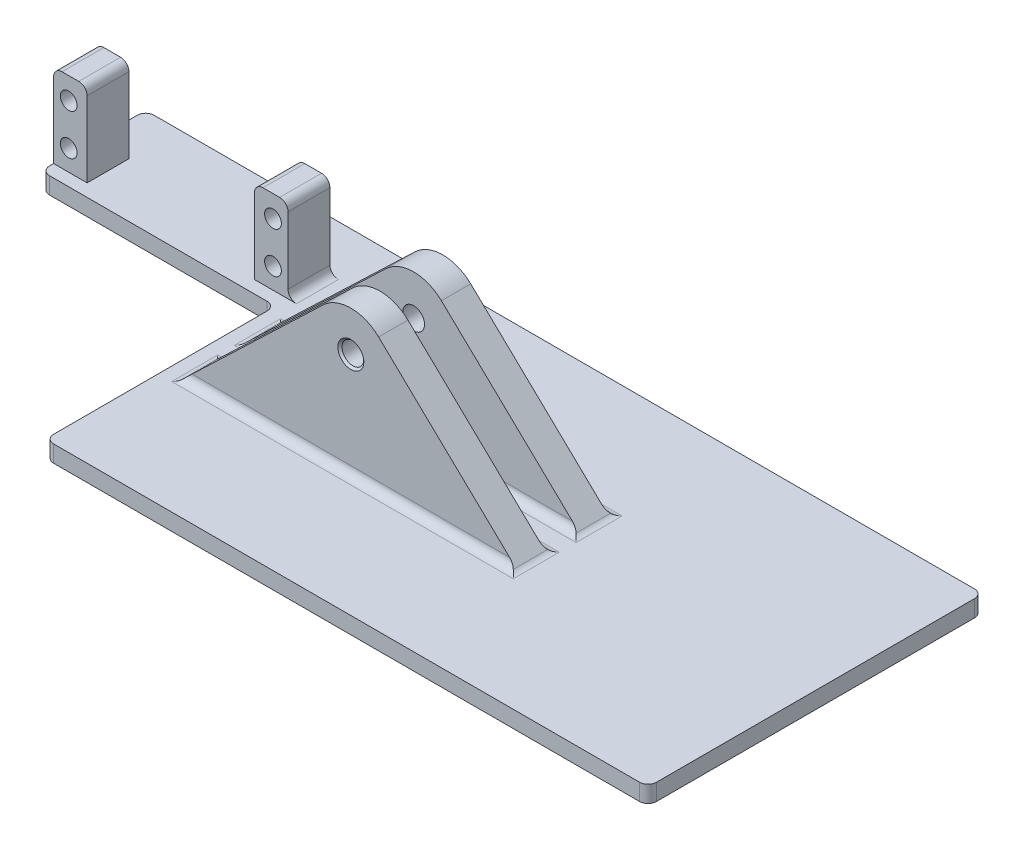
from build123d import *

# Parameters (mm, degrees)
SKETCH1_R           = 2.6
BOSS_EXTRUDE1_DEPTH = 22
SKETCH2_W           = 200
SKETCH2_H           = 80
BOSS_EXTRUDE2_DEPTH = 4
SKETCH3_W           = 8
SKETCH3_H           = 35
CUT_EXTRUDE1_DEPTH  = 209.42744541
CHAMFER1_SIZE       = 0.5
BOSS_EXTRUDE3_START = -22
SKETCH4_W           = 8
SKETCH4_H           = 20
SKETCH4_R           = 2
BOSS_EXTRUDE3_DEPTH = 10
SKETCH5_W           = 56
SKETCH5_H           = 55
CUT_EXTRUDE2_DEPTH  = 7
FILLET1_R           = 2


with BuildPart() as part:
    # Sketch1 → Boss-Extrude1 (new body)
    with BuildSketch(Plane.XY):
        with BuildLine():
            Line((-6.63831163, 6.934898608), (-40, -25))
            Line((-40, -25), (40, -25))
            Line((40, -25), (6.63831163, 6.934898608))
            ThreePointArc((6.63831163, 6.934898608), (0, 9.6), (-6.63831163, 6.934898608))
        make_face()
        Circle(SKETCH1_R, mode=Mode.SUBTRACT)
    extrude(amount=BOSS_EXTRUDE1_DEPTH)

    # Sketch2 → Boss-Extrude2 (add)
    with BuildSketch(Plane(origin=(0, -25, 0), x_dir=(-1, 0, 0), z_dir=(0, -1, 0))):
        with Locations((0, -11)):
            Rectangle(SKETCH2_W, SKETCH2_H)
    extrude(amount=BOSS_EXTRUDE2_DEPTH)

    # Sketch3 → Cut-Extrude1 (cut, through all)
    with BuildSketch(Plane(origin=(100, 0, 0), x_dir=(0, 0, -1), z_dir=(1, 0, 0))):
        with Locations((-11, -7.5)):
            Rectangle(SKETCH3_W, SKETCH3_H)
    extrude(amount=-CUT_EXTRUDE1_DEPTH, mode=Mode.SUBTRACT)

    # Chamfer1
    chamfer1_edges = [part.edges().sort_by_distance(p)[0] for p in [
        (-2.6, 0, 0),
        (-2.6, 0, 22),
    ]]
    chamfer(chamfer1_edges, length=CHAMFER1_SIZE)

    # Sketch4 → Boss-Extrude3 (add)
    # profile 1 of 2: a face of its own
    with BuildSketch(Plane(origin=(0, 0, -29), x_dir=(-1, 0, 0), z_dir=(0, 0, -1)).offset(BOSS_EXTRUDE3_START)):
        with Locations((96, -15)):
            Rectangle(SKETCH4_W, SKETCH4_H)
        with Locations((96.4, -20)):
            Circle(SKETCH4_R, mode=Mode.SUBTRACT)
        with Locations((96.4, -10.2)):
            Circle(SKETCH4_R, mode=Mode.SUBTRACT)
    # profile 2 of 2: a face of its own
    with BuildSketch(Plane(origin=(0, 0, -29), x_dir=(-1, 0, 0), z_dir=(0, 0, -1)).offset(BOSS_EXTRUDE3_START)):
        with Locations((48, -15)):
            Rectangle(SKETCH4_W, SKETCH4_H)
        with Locations(Location((47.6, -20, 0), (0, 0, 180))):
            Circle(SKETCH4_R, mode=Mode.SUBTRACT)
        with Locations(Location((47.6, -10.2, 0), (0, 0, 180))):
            Circle(SKETCH4_R, mode=Mode.SUBTRACT)
    extrude(amount=BOSS_EXTRUDE3_DEPTH)

    # Sketch5 → Cut-Extrude2 (cut)
    with BuildSketch(Plane(origin=(0, -25, 0), x_dir=(1, 0, 0), z_dir=(0, 1, 0))):
        with Locations((-72, -23.5)):
            Rectangle(SKETCH5_W, SKETCH5_H)
    extrude(amount=-CUT_EXTRUDE2_DEPTH, mode=Mode.SUBTRACT)

    # Fillet1
    fillet1_edges = [part.edges().sort_by_distance(p)[0] for p in [
        (-100, -5, -12),
        (-92, -5, -12),
        (-44, -5, -12),
        (-52, -5, -12),
        (-44, -25, -12),
        (0, -25, 0),
        (0, -25, 15),
        (-40, -25, 18.5),
        (0, -25, 7),
        (-40, -25, 3.5),
        (0, -25, 22),
        (40, -25, 3.5),
        (40, -25, 18.5),
        (100, -27, -29),
        (100, -27, 51),
        (-100, -27, -29),
        (-44, -27, -4),
        (-44, -27, 51),
        (-100, -27, -4),
    ]]
    fillet(fillet1_edges, radius=FILLET1_R)


solid = part.part
